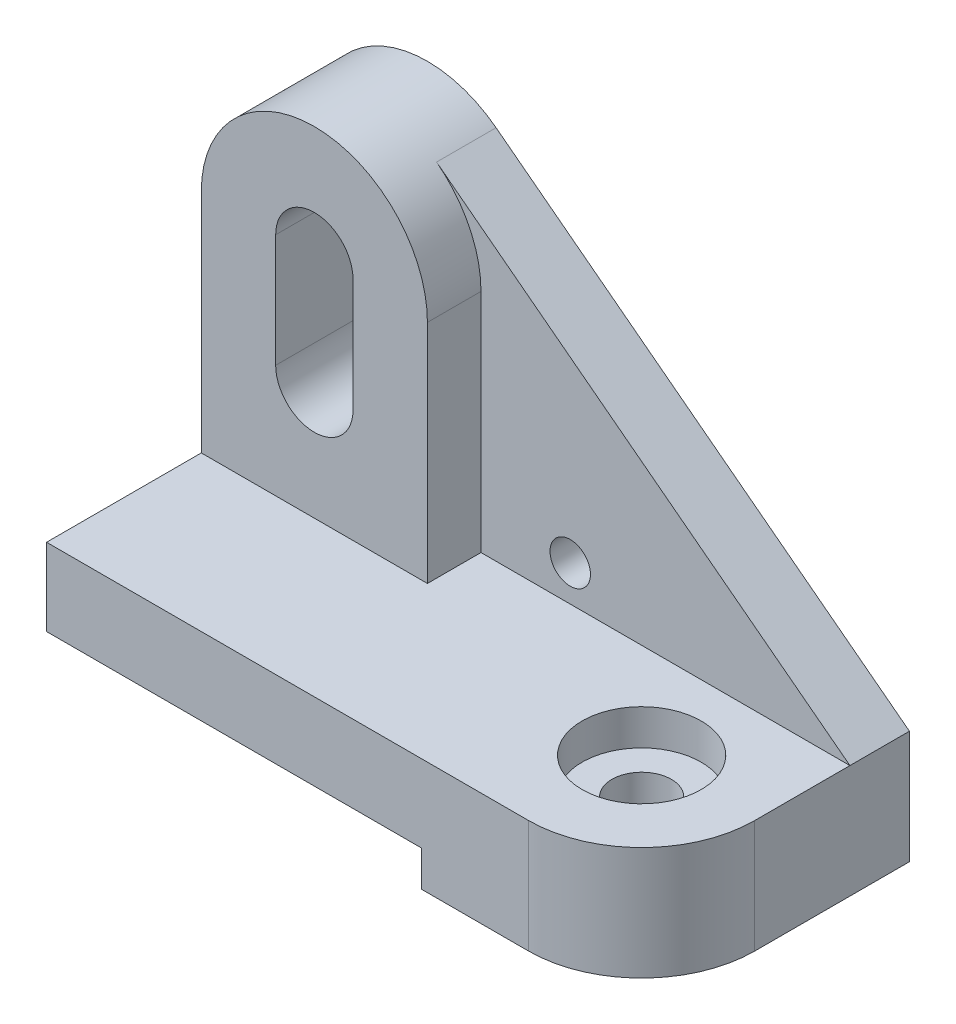
from build123d import *

# Parameters (mm, degrees)
BOSS_EXTRUDE1_DEPTH = 45
BOSS_EXTRUDE2_DEPTH = 10
BOSS_EXTRUDE3_DEPTH = 9
CUT_EXTRUDE1_DEPTH  = 119.004237212
FILLET1_R           = 19
HOLE1_D             = 10
HOLE1_CBORE_D       = 20
HOLE1_CBORE_DEPTH   = 6
M8_TAPPED_HOLE2_D   = 6.8


with BuildPart() as part:
    # Sketch1 → Boss-Extrude1 (new body)
    with BuildSketch(Plane.XY):
        Polygon((0, 0), (0, -13), (63, -13), (63, -19), (100, -19), (100, 0), align=None)
    extrude(amount=BOSS_EXTRUDE1_DEPTH)

    # Sketch2 → Boss-Extrude2 (add)
    with BuildSketch(Plane(origin=(0, 0, 0), x_dir=(-1, 0, 0), z_dir=(0, 0, -1))):
        with BuildLine():
            Line((0, 0), (0, 38))
            ThreePointArc((0, 38), (-10.580703715, 55.032775759), (-30.538468428, 53.095156386))
            Line((-30.538468428, 53.095156386), (-100, 0))
            Line((-100, 0), (0, 0))
        make_face()
    extrude(amount=-BOSS_EXTRUDE2_DEPTH)

    # Sketch4 → Boss-Extrude3 (add)
    with BuildSketch(Plane.XY.offset(10)):
        with BuildLine():
            Line((0, 0), (0, 38))
            ThreePointArc((0, 38), (19, 57), (38, 38))
            Line((38, 38), (38, 0))
            Line((38, 0), (0, 0))
        make_face()
    extrude(amount=BOSS_EXTRUDE3_DEPTH)

    # Sketch5 → Cut-Extrude1 (cut, through all)
    with BuildSketch(Plane.XY.offset(19)):
        with BuildLine():
            Line((25.5, 38), (25.5, 19))
            ThreePointArc((25.5, 19), (19, 12.5), (12.5, 19))
            Line((12.5, 19), (12.5, 38))
            ThreePointArc((12.5, 38), (19, 44.5), (25.5, 38))
        make_face()
    extrude(amount=-CUT_EXTRUDE1_DEPTH, mode=Mode.SUBTRACT)

    # Fillet1
    fillet1_edges = [part.edges().sort_by_distance(p)[0] for p in [
        (100, -9.5, 45),
    ]]
    fillet(fillet1_edges, radius=FILLET1_R)

    # Hole1 (through all)
    with Locations(Plane(origin=(81, 0, 26), x_dir=(1, 0, 0), z_dir=(0, 1, 0))):
        with Locations((0, 0)):
            CounterBoreHole(HOLE1_D / 2, HOLE1_CBORE_D / 2, HOLE1_CBORE_DEPTH)

    # M8 Tapped Hole2 (through all)
    with Locations(Plane(origin=(53, 6, 10), x_dir=(1, 0, 0), z_dir=(0, 0, 1))):
        with Locations((0, 0)):
            Hole(M8_TAPPED_HOLE2_D / 2)


solid = part.part
